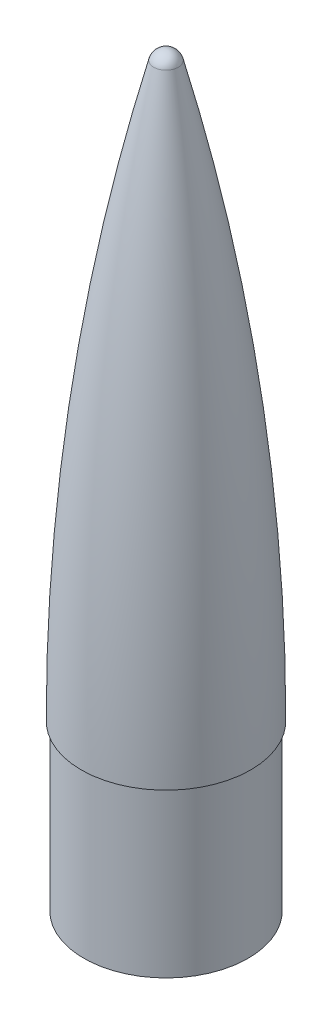
from build123d import *


with BuildPart() as part:
    # Sketch1 → Revolve1 (revolve)
    with BuildSketch(Plane.XY, mode=Mode.PRIVATE) as revolve1_sk:
        with BuildLine():
            Line((0, 0), (32.5, 0))
            Line((32.5, 0), (32.5, 65))
            Line((32.5, 65), (33.5, 65))
            ThreePointArc((33.5, 65), (26.307013023, 179.02722165), (4.842089147, 291.246664625))
            ThreePointArc((4.842089147, 291.246664625), (3.063223537, 293.951792196), (0, 295))
            Line((0, 295), (0, 0))
        make_face()
    revolve(revolve1_sk.sketch.rotate(Axis((0, 0, 0), (0, 1, 0)), 90), axis=Axis((0, 0, 0), (0, 1, 0)))


solid = part.part
